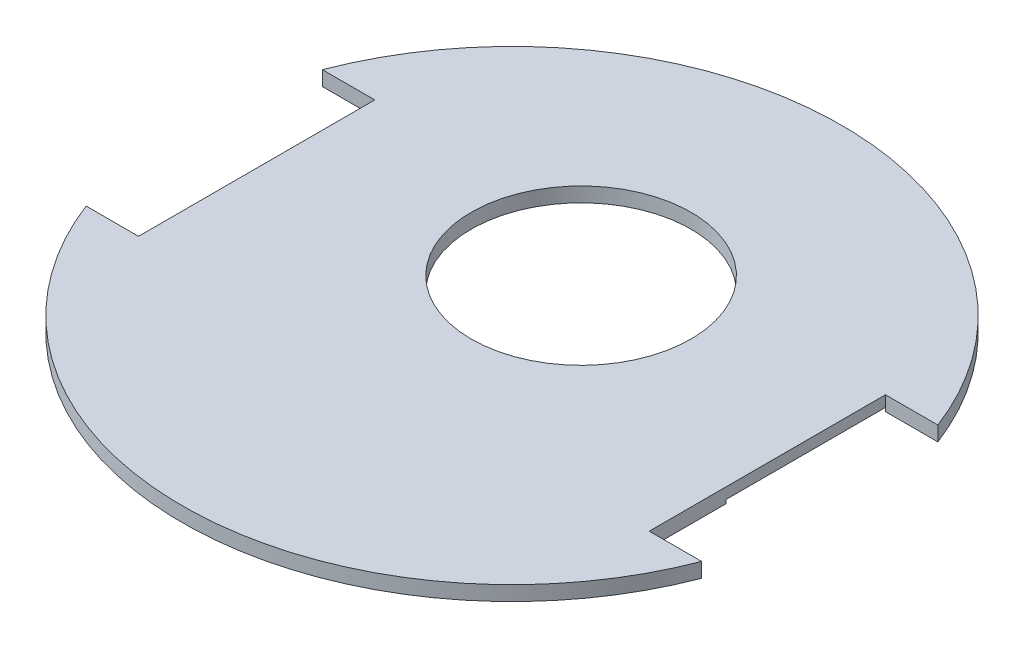
from build123d import *

# Parameters (mm, degrees)
SKETCH_2_R               = 90
EXTRUDE_1_DEPTH          = 4
CUT_EXTRUDE_1_DEPTH      = 128.342059038
CUT_EXTRUDE_1_DEPTH_BACK = 10
CUT_EXTRUDE_2_DEPTH      = 1
CUT_EXTRUDE_2_DEPTH_BACK = 1
SKETCH_2_7_W             = 22.4
SKETCH_2_7_H             = 65.5
SKETCH_2_8_R             = 30
CUT_EXTRUDE_4_DEPTH      = 124.190655084
CUT_EXTRUDE_5_DEPTH      = 1
CUT_EXTRUDE_5_DEPTH_BACK = 1
SKETCH_2_9_W             = 75.7
SKETCH_2_9_H             = 60.7
CUT_EXTRUDE_6_DEPTH      = 1
CUT_EXTRUDE_6_DEPTH_BACK = 1
SKETCH_2_10_R            = 17.5


with BuildPart() as part:
    # 草圖2 → 填料-伸長1 (new body)
    with BuildSketch(Plane(origin=(0, 0, 0), x_dir=(1, 0, 0), z_dir=(0, 1, 0))):
        Circle(SKETCH_2_R)
    extrude(amount=EXTRUDE_1_DEPTH)

    # 草圖2<5> → 除料-伸長1 (cut, two sides: drawn at the far end of the back side and taken through both)
    with BuildSketch(Plane(origin=(0, 0, 0), x_dir=(1, 0, 0), z_dir=(0, 1, 0)).offset(-CUT_EXTRUDE_1_DEPTH_BACK)):
        with BuildLine():
            Line((84.023434231, 32.25), (69.717716958, 32.25))
            Line((69.717716958, 32.25), (69.717716958, -32.25))
            Line((69.717716958, -32.25), (84.023434231, -32.25))
            ThreePointArc((84.023434231, -32.25), (90, 0), (84.023434231, 32.25))
        make_face()
        with BuildLine():
            Line((-69.717716958, 32.25), (-84.023434231, 32.25))
            ThreePointArc((-84.023434231, 32.25), (-90, 0), (-84.023434231, -32.25))
            Line((-84.023434231, -32.25), (-69.717716958, -32.25))
            Line((-69.717716958, -32.25), (-69.717716958, 32.25))
        make_face()
    extrude(amount=CUT_EXTRUDE_1_DEPTH + CUT_EXTRUDE_1_DEPTH_BACK, mode=Mode.SUBTRACT)

    # 草圖2<7> → 除料-伸長2 (cut, two sides: drawn at the far end of the back side and taken through both)
    with BuildSketch(Plane(origin=(0, 0, 0), x_dir=(1, 0, 0), z_dir=(0, 1, 0)).offset(-CUT_EXTRUDE_2_DEPTH_BACK)):
        with Locations((58.517716958, 21.408982887)):
            Rectangle(SKETCH_2_7_W, SKETCH_2_7_H)
        with Locations((-58.517716958, 21.408982887)):
            Rectangle(SKETCH_2_7_W, SKETCH_2_7_H)
    extrude(amount=CUT_EXTRUDE_2_DEPTH + CUT_EXTRUDE_2_DEPTH_BACK, mode=Mode.SUBTRACT)

    # 草圖2<8> → 除料-伸長4 (cut, through all)
    with BuildSketch(Plane(origin=(0, 0, 0), x_dir=(1, 0, 0), z_dir=(0, 1, 0))):
        with Locations((0, 18.868843399)):
            Circle(SKETCH_2_8_R)
    extrude(amount=CUT_EXTRUDE_4_DEPTH, mode=Mode.SUBTRACT)

    # 草圖2<9> → 除料-伸長5 (cut, two sides: drawn at the far end of the back side and taken through both)
    with BuildSketch(Plane(origin=(0, 0, 0), x_dir=(1, 0, 0), z_dir=(0, 1, 0)).offset(-CUT_EXTRUDE_5_DEPTH_BACK)):
        with Locations((0, -46.344841494)):
            Rectangle(SKETCH_2_9_W, SKETCH_2_9_H)
    extrude(amount=CUT_EXTRUDE_5_DEPTH + CUT_EXTRUDE_5_DEPTH_BACK, mode=Mode.SUBTRACT)

    # 草圖2<10> → 除料-伸長6 (cut, two sides: drawn at the far end of the back side and taken through both)
    with BuildSketch(Plane(origin=(0, 0, 0), x_dir=(1, 0, 0), z_dir=(0, 1, 0)).offset(-CUT_EXTRUDE_6_DEPTH_BACK)):
        with Locations((0, 71.575794202)):
            Circle(SKETCH_2_10_R)
    extrude(amount=CUT_EXTRUDE_6_DEPTH + CUT_EXTRUDE_6_DEPTH_BACK, mode=Mode.SUBTRACT)


solid = part.part
